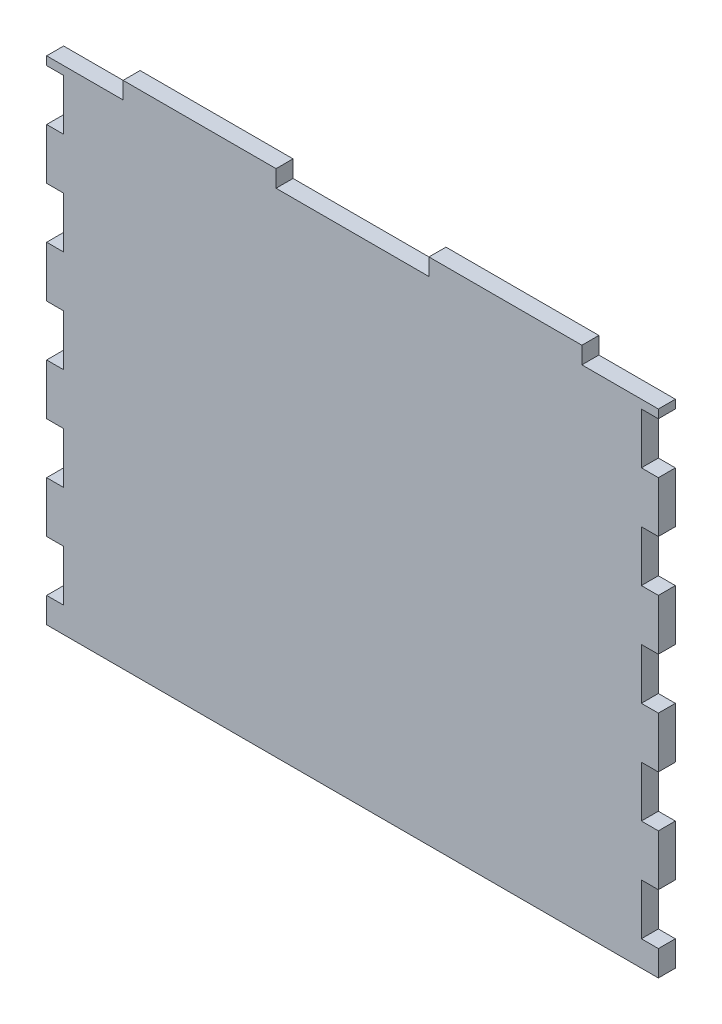
from build123d import *

# Parameters (mm, degrees)
BOSS_EXTRUDE1_DEPTH = 6.35


with BuildPart() as part:
    # Sketch1 → Boss-Extrude1 (new body)
    with BuildSketch(Plane.XY):
        Polygon((85.725, 95.25), (28.575, 95.25), (28.575, 88.9), (-28.575, 88.9), (-28.575, 95.25), (-85.725, 95.25), (-85.725, 88.9), (-114.3, 88.9), (-114.3, 85.725), (-107.95, 85.725), (-107.95, 66.675), (-114.3, 66.675), (-114.3, 47.625), (-107.95, 47.625), (-107.95, 28.575), (-114.3, 28.575), (-114.3, 9.525), (-107.95, 9.525), (-107.95, -9.525), (-114.3, -9.525), (-114.3, -28.575), (-107.95, -28.575), (-107.95, -47.625), (-114.3, -47.625), (-114.3, -66.675), (-107.95, -66.675), (-107.95, -85.725), (-114.3, -85.725), (-114.3, -95.25), (114.3, -95.25), (114.3, -85.725), (107.95, -85.725), (107.95, -66.675), (114.3, -66.675), (114.3, -47.625), (107.95, -47.625), (107.95, -28.575), (114.3, -28.575), (114.3, -9.525), (107.95, -9.525), (107.95, 9.525), (114.3, 9.525), (114.3, 28.575), (107.95, 28.575), (107.95, 47.625), (114.3, 47.625), (114.3, 66.675), (107.95, 66.675), (107.95, 85.725), (114.3, 85.725), (114.3, 88.9), (85.725, 88.9), align=None)
    extrude(amount=BOSS_EXTRUDE1_DEPTH)


solid = part.part
